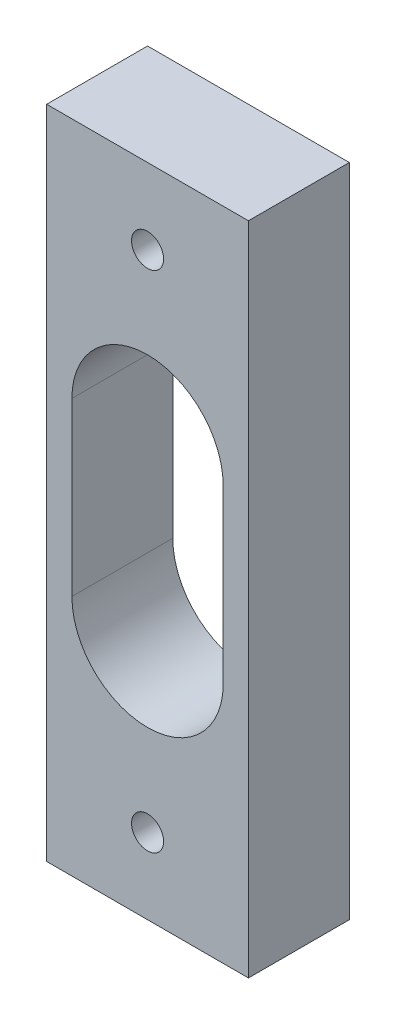
from build123d import *

# Parameters (mm, degrees)
SKETCH1_W                           = 25.4
SKETCH1_H                           = 12.7
BOSS_EXTRUDE1_DEPTH                 = 82.55
F_10_32_TAPPED_HOLE_TOP_HOLD_D      = 4.0386
F_8_32_TAPPED_HOLE_SIDE_PLATE_D     = 3.4544
F_8_32_TAPPED_HOLE_SIDE_PLATE_DEPTH = 12.2936
F_8_32_TAPPED_HOLE_SIDE_PLATE_TIP   = 1.037806461
CUT_EXTRUDE1_DEPTH                  = 88.298066989


with BuildPart() as part:
    # Sketch1 → Boss-Extrude1 (new body)
    with BuildSketch(Plane(origin=(0, 0, 0), x_dir=(1, 0, 0), z_dir=(0, 1, 0))):
        with Locations((12.7, 6.35)):
            Rectangle(SKETCH1_W, SKETCH1_H)
    extrude(amount=BOSS_EXTRUDE1_DEPTH)

    # #10-32 Tapped Hole - Top Hold (through all)
    with Locations(Plane(origin=(0, 0, -12.7), x_dir=(-1, 0, 0), z_dir=(0, 0, -1))):
        with Locations((-12.7, 9.525), (-12.7, 73.025)):
            Hole(F_10_32_TAPPED_HOLE_TOP_HOLD_D / 2)

    # #8-32 Tapped Hole - Side Plate
    with Locations(Plane.ZY):
        with Locations((-6.35, 19.05), (-6.35, 63.5)):
            Hole(F_8_32_TAPPED_HOLE_SIDE_PLATE_D / 2, depth=F_8_32_TAPPED_HOLE_SIDE_PLATE_DEPTH)
            with Locations((0, 0, -(F_8_32_TAPPED_HOLE_SIDE_PLATE_DEPTH + F_8_32_TAPPED_HOLE_SIDE_PLATE_TIP / 2))):  # 118° drill point
                Cone(0, F_8_32_TAPPED_HOLE_SIDE_PLATE_D / 2, F_8_32_TAPPED_HOLE_SIDE_PLATE_TIP, mode=Mode.SUBTRACT)

    # Sketch8 → Cut-Extrude1 (cut, through all)
    with BuildSketch(Plane(origin=(0, 0, -12.7), x_dir=(-1, 0, 0), z_dir=(0, 0, -1))):
        with BuildLine():
            Line((-22.225, 30.48), (-22.225, 52.07))
            ThreePointArc((-22.225, 52.07), (-12.7, 61.595), (-3.175, 52.07))
            Line((-3.175, 52.07), (-3.175, 30.48))
            ThreePointArc((-3.175, 30.48), (-12.7, 20.955), (-22.225, 30.48))
        make_face()
    extrude(amount=-CUT_EXTRUDE1_DEPTH, mode=Mode.SUBTRACT)


solid = part.part
